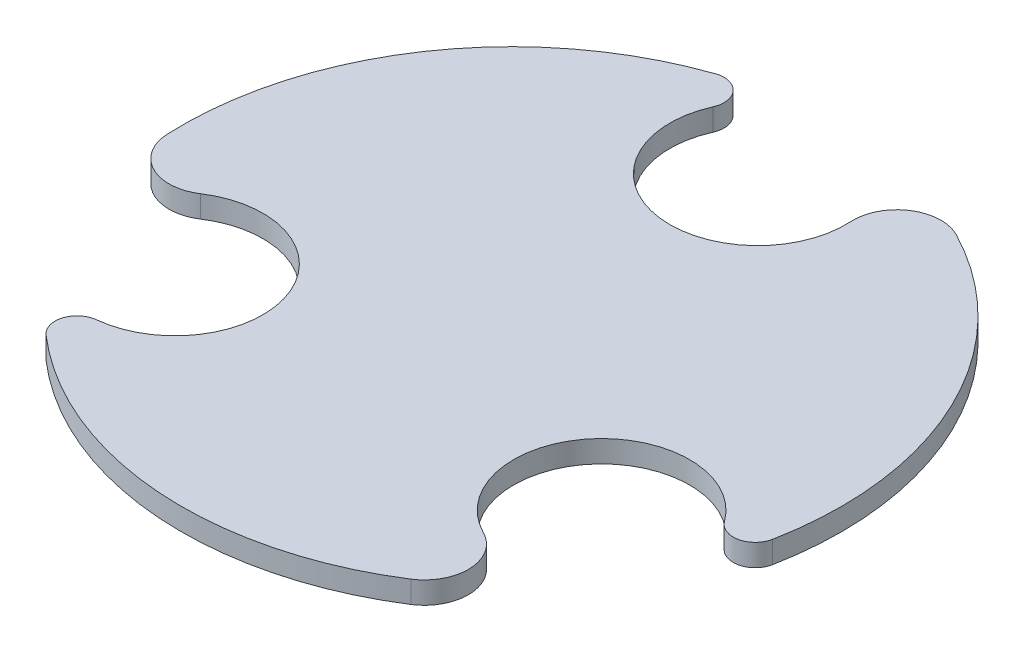
from build123d import *

# Parameters (mm, degrees)
SKETCH2_R           = 75
BOSS_EXTRUDE2_DEPTH = 5
SKETCH3_R           = 20
CUT_EXTRUDE2_DEPTH  = 107.183802908
FILLET2_R           = 10
FILLET3_R           = 5


with BuildPart() as part:
    # Sketch2 → Boss-Extrude2 (new body)
    with BuildSketch(Plane(origin=(0, 0, 0), x_dir=(1, 0, 0), z_dir=(0, 1, 0))):
        with Locations(Location((0, 0, 0), (0, 0, 270))):
            Circle(SKETCH2_R)
    extrude(amount=BOSS_EXTRUDE2_DEPTH)

    # Sketch3 → Cut-Extrude2 (cut, through all)
    with BuildSketch(Plane(origin=(0, 5, 0), x_dir=(1, 0, 0), z_dir=(0, 1, 0))):
        with Locations((0, 56)):
            Circle(SKETCH3_R)
        with Locations((48.497422612, -28)):
            Circle(SKETCH3_R)
        with Locations((-48.497422612, -28)):
            Circle(SKETCH3_R)
    extrude(amount=-CUT_EXTRUDE2_DEPTH, mode=Mode.SUBTRACT)

    # Fillet2
    fillet2_edges = [part.edges().sort_by_distance(p)[0] for p in [
        (7.218787271, 2.5, -74.651785714),
        (61.040949231, 2.5, 43.577546019),
        (-68.259736502, 2.5, 31.074239696),
    ]]
    fillet(fillet2_edges, radius=FILLET2_R)

    # Fillet3
    fillet3_edges = [part.edges().sort_by_distance(p)[0] for p in [
        (-7.218787271, 2.5, -74.651785714),
        (68.259736502, 2.5, 31.074239696),
        (-61.040949231, 2.5, 43.577546019),
    ]]
    fillet(fillet3_edges, radius=FILLET3_R)


solid = part.part
